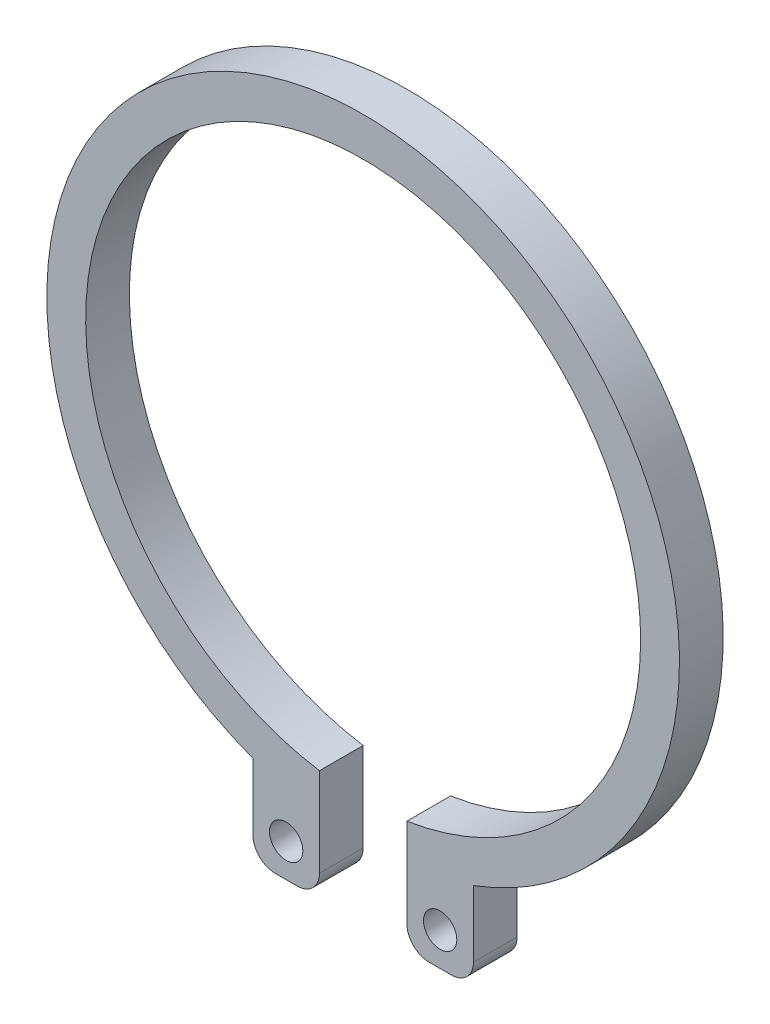
from build123d import *

# Parameters (mm, degrees)
SKETCH1_R           = 3.6195
SKETCH1_R_2         = 3.175
BOSS_EXTRUDE1_DEPTH = 0.5
CUT_EXTRUDE1_DEPTH  = 6.143108058
SKETCH3_W           = 0.762
SKETCH3_H           = 1.27
SKETCH3_R           = 0.1905
BOSS_EXTRUDE2_DEPTH = 0.5
FILLET1_R           = 0.254


with BuildPart() as part:
    # Sketch1 → Boss-Extrude1 (new body)
    with BuildSketch(Plane.XY):
        Circle(SKETCH1_R)
        Circle(SKETCH1_R_2, mode=Mode.SUBTRACT)
    extrude(amount=BOSS_EXTRUDE1_DEPTH)

    # Sketch2 → Cut-Extrude1 (cut, through all)
    with BuildSketch(Plane.XY.offset(0.5)):
        Polygon((0.5, -2.208183393), (0.5, -4.13884283), (-0.5, -4.13884283), (-0.5, -2.208183393), (-0.5, 2.208183393), (0.5, 2.208183393), align=None)
    extrude(amount=-CUT_EXTRUDE1_DEPTH, mode=Mode.SUBTRACT)

    # Sketch3 → Boss-Extrude2 (add)
    # profile 1 of 2: a face of its own
    with BuildSketch(Plane(origin=(0, 0, 0), x_dir=(-1, 0, 0), z_dir=(0, 0, -1))):
        with Locations((0.881, -3.770382752)):
            Rectangle(SKETCH3_W, SKETCH3_H)
        with Locations((0.881, -4.024382752)):
            Circle(SKETCH3_R, mode=Mode.SUBTRACT)
    # profile 2 of 2: a face of its own
    with BuildSketch(Plane(origin=(0, 0, 0), x_dir=(-1, 0, 0), z_dir=(0, 0, -1))):
        with Locations((-0.881, -3.770382752)):
            Rectangle(SKETCH3_W, SKETCH3_H)
        with Locations((-0.881, -4.024382752)):
            Circle(SKETCH3_R, mode=Mode.SUBTRACT)
    extrude(amount=-BOSS_EXTRUDE2_DEPTH)

    # Fillet1
    fillet1_edges = [part.edges().sort_by_distance(p)[0] for p in [
        (-0.5, -4.405382752, 0.25),
        (-1.262, -4.405382752, 0.25),
        (1.262, -4.405382752, 0.25),
        (0.5, -4.405382752, 0.25),
    ]]
    fillet(fillet1_edges, radius=FILLET1_R)


solid = part.part
